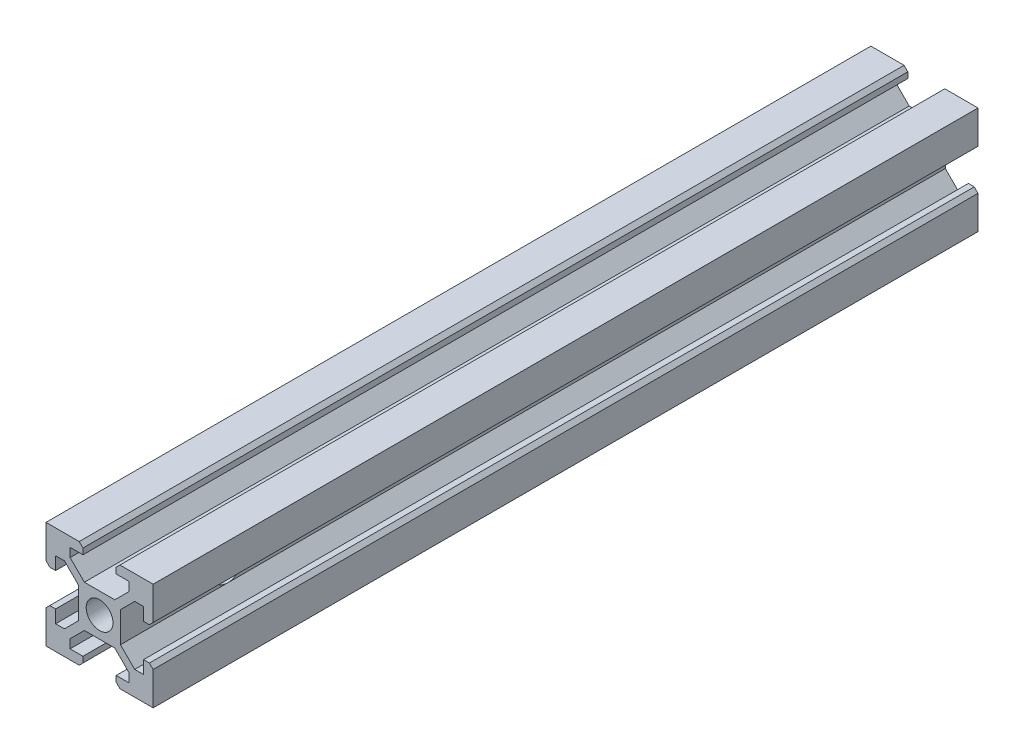
from build123d import *

# Parameters (mm, degrees)
SKETCH1_R               = 2.5
BOSS_EXTRUDE1_DEPTH     = 77
CUT_EXTRUDE1_DEPTH      = 79.880986302
CUT_EXTRUDE1_DEPTH_BACK = 79.880986302
SKETCH2_R               = 2.839339828


with BuildPart() as part:
    # Sketch1 → Boss-Extrude1 (new, symmetric)
    with BuildSketch(Plane.XY):
        Polygon((3.9, -2.839339828), (6.560660172, -5.5), (8.200660172, -5.5), (8.200660172, -3.1), (9.3, -3.1), (10, -3.8), (10, -10), (3.8, -10), (3.1, -9.3), (3.1, -8.200660172), (5.5, -8.200660172), (5.5, -6.560660172), (2.839339828, -3.9), (-2.839339828, -3.9), (-5.5, -6.560660172), (-5.5, -8.200660172), (-3.1, -8.200660172), (-3.1, -9.3), (-3.8, -10), (-10, -10), (-10, -3.8), (-9.3, -3.1), (-8.200660172, -3.1), (-8.200660172, -5.5), (-6.560660172, -5.5), (-3.9, -2.839339828), (-3.9, 2.839339828), (-6.560660172, 5.5), (-8.200660172, 5.5), (-8.200660172, 3.1), (-9.3, 3.1), (-10, 3.8), (-10, 10), (-3.8, 10), (-3.1, 9.3), (-3.1, 8.200660172), (-5.5, 8.200660172), (-5.5, 6.560660172), (-2.839339828, 3.9), (2.839339828, 3.9), (5.5, 6.560660172), (5.5, 8.200660172), (3.1, 8.200660172), (3.1, 9.3), (3.8, 10), (10, 10), (10, 3.8), (9.3, 3.1), (8.200660172, 3.1), (8.200660172, 5.5), (6.560660172, 5.5), (3.9, 2.839339828), align=None)
        Circle(SKETCH1_R, mode=Mode.SUBTRACT)
    extrude(amount=BOSS_EXTRUDE1_DEPTH, both=True)

    # Sketch2 → Cut-Extrude1 (cut, two sides: drawn at the far end of the back side and taken through both)
    with BuildSketch(Plane(origin=(3.9, 0, 0), x_dir=(0, 0, -1), z_dir=(1, 0, 0)).offset(-CUT_EXTRUDE1_DEPTH_BACK)):
        with Locations(Location((-57, 0, 0), (0, 0, 90))):
            Circle(SKETCH2_R)
    extrude(amount=CUT_EXTRUDE1_DEPTH + CUT_EXTRUDE1_DEPTH_BACK, mode=Mode.SUBTRACT)


solid = part.part
